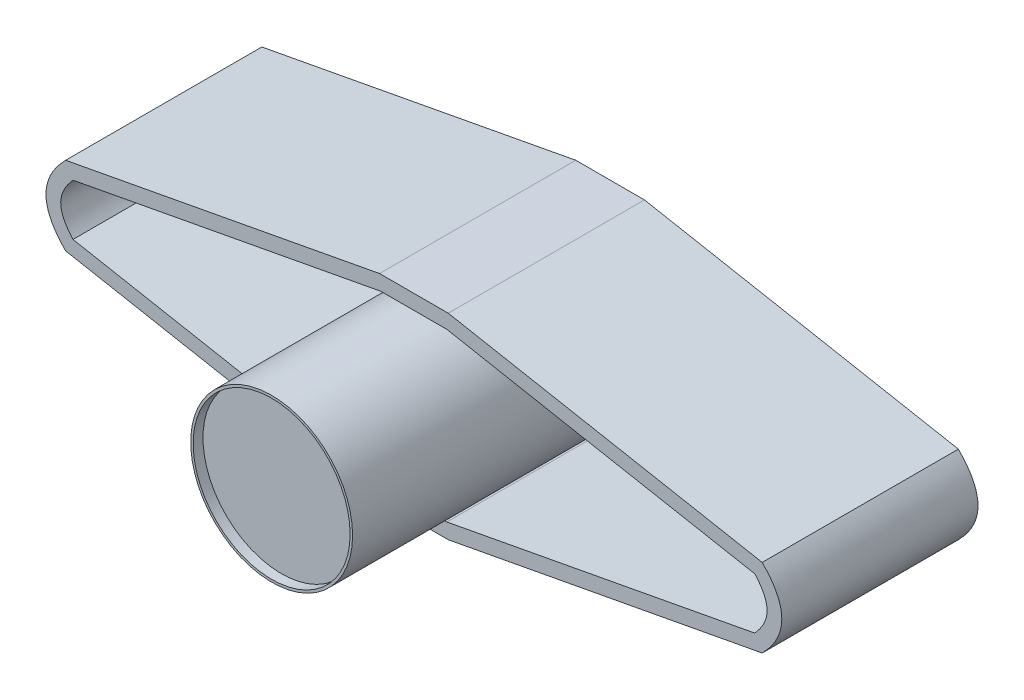
from build123d import *

# Parameters (mm, degrees)
BOSS_EXTRUDE1_DEPTH = 20
SHELL2_T            = -1.5
SKETCH4_R           = 8.25
BOSS_EXTRUDE6_DEPTH = 33
SKETCH5_R           = 8
CUT_EXTRUDE1_DEPTH  = 1


with BuildPart() as part:
    # Sketch1 → Boss-Extrude1 (new body)
    with BuildSketch(Plane.XY):
        with BuildLine():
            Line((-35.5, 4), (-3.5, 10))
            Line((-3.5, 10), (3.5, 10))
            Line((3.5, 10), (35.5, 4))
            add(Edge.make_bspline(
                [(35.5, 4), (39.5, 0), (35.5, -4)],
                knots=[0, 0, 0, 1, 1, 1], degree=2))
            Line((35.5, -4), (3.5, -10))
            Line((3.5, -10), (-3.5, -10))
            Line((-3.5, -10), (-35.5, -4))
            add(Edge.make_bspline(
                [(-35.5, 4), (-39.5, 0), (-35.5, -4)],
                knots=[0, 0, 0, 1, 1, 1], degree=2))
        make_face()
    extrude(amount=BOSS_EXTRUDE1_DEPTH)

    # Shell2
    shell2_openings = [part.faces().sort_by_distance(p)[0] for p in [
        (0, 0, 20),
    ]]
    offset(amount=SHELL2_T, openings=shell2_openings, kind=Kind.INTERSECTION)

    # Sketch4 → Boss-Extrude6 (add)
    with BuildSketch(Plane.XY.offset(1.5)):
        Circle(SKETCH4_R)
    extrude(amount=BOSS_EXTRUDE6_DEPTH)

    # Sketch5 → Cut-Extrude1 (cut)
    with BuildSketch(Plane.XY.offset(34.5)):
        Circle(SKETCH5_R)
    extrude(amount=-CUT_EXTRUDE1_DEPTH, mode=Mode.SUBTRACT)


solid = part.part
